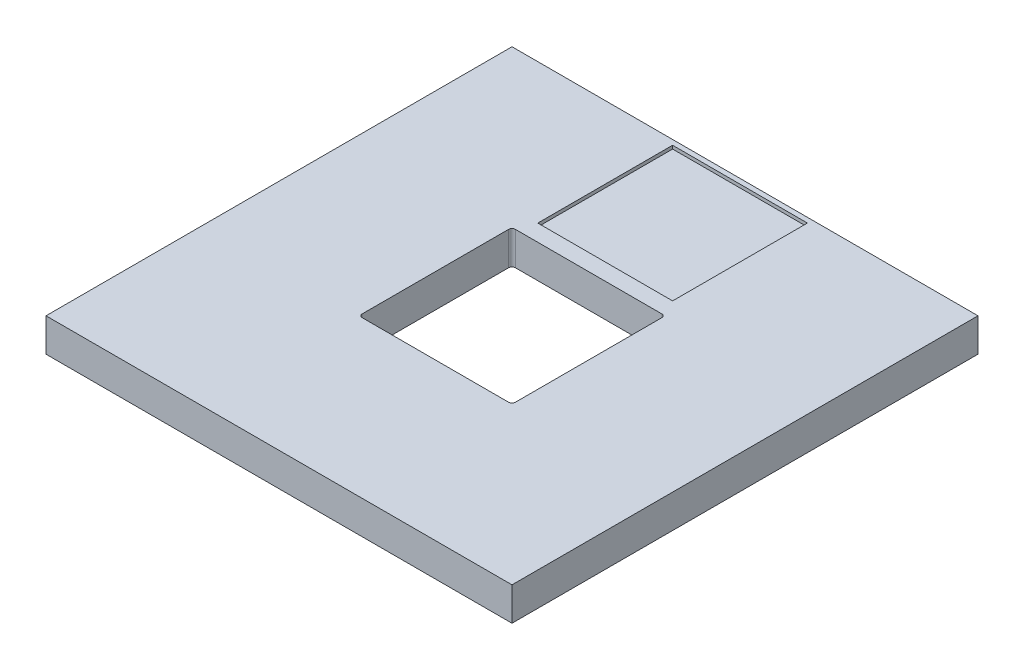
from build123d import *

# Parameters (mm, degrees)
SKIZZE1_W                       = 140
SKIZZE1_H                       = 140
SKIZZE1_W_2                     = 46
SKIZZE1_H_2                     = 46
AUFSATZ_LINEAR_AUSTRAGEN1_DEPTH = 10
SKIZZE3_W                       = 40.5
SKIZZE3_H                       = 40.5
SCHNITT_LINEAR_AUSTRAGEN1_DEPTH = 1
VERRUNDUNG1_R                   = 1


with BuildPart() as part:
    # Skizze1 → Aufsatz-Linear austragen1 (new body)
    with BuildSketch(Plane(origin=(0, 0, 0), x_dir=(1, 0, 0), z_dir=(0, 1, 0))):
        with Locations((70, 70)):
            Rectangle(SKIZZE1_W, SKIZZE1_H)
        with Locations((70, 70)):
            Rectangle(SKIZZE1_W_2, SKIZZE1_H_2, mode=Mode.SUBTRACT)
    extrude(amount=AUFSATZ_LINEAR_AUSTRAGEN1_DEPTH)

    # Skizze3 → Schnitt-Linear austragen1 (cut)
    with BuildSketch(Plane(origin=(0, 10, 0), x_dir=(1, 0, 0), z_dir=(0, 1, 0))):
        with Locations((70, 118.25)):
            Rectangle(SKIZZE3_W, SKIZZE3_H)
    extrude(amount=-SCHNITT_LINEAR_AUSTRAGEN1_DEPTH, mode=Mode.SUBTRACT)

    # Verrundung1
    verrundung1_edges = [part.edges().sort_by_distance(p)[0] for p in [
        (47, 5, -93),
        (47, 5, -47),
        (93, 5, -47),
        (93, 5, -93),
    ]]
    fillet(verrundung1_edges, radius=VERRUNDUNG1_R)


solid = part.part
